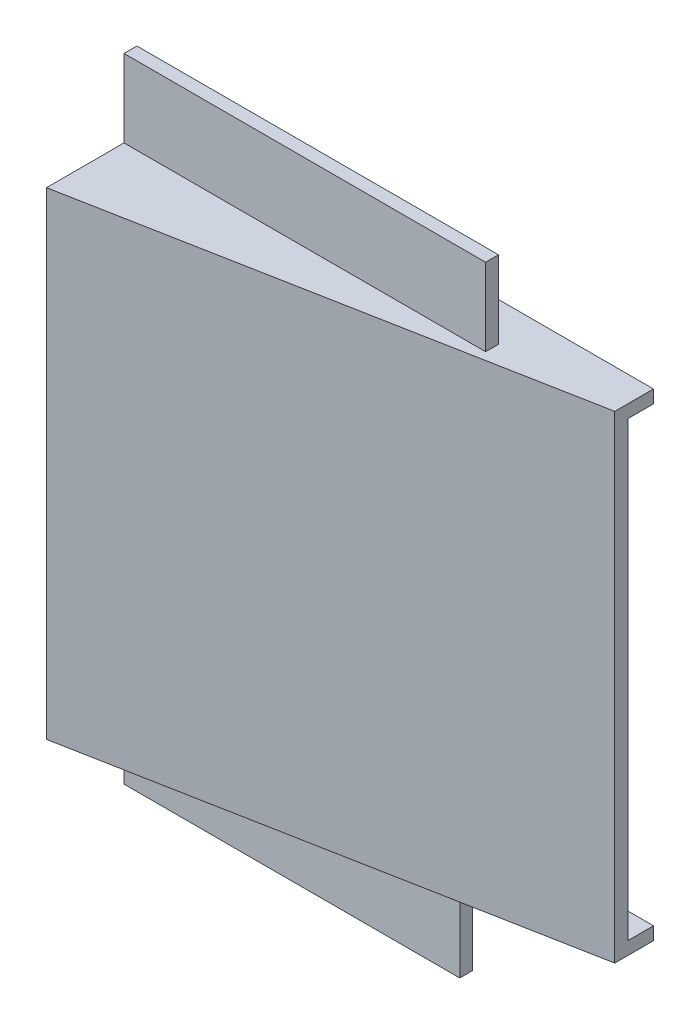
from build123d import *

# Parameters (mm, degrees)
SKETCH1_W           = 185
SKETCH1_H           = 185
BOSS_EXTRUDE1_DEPTH = 50
CUT_EXTRUDE1_DEPTH  = 190
CUT_EXTRUDE3_START  = -5
CUT_EXTRUDE3_DEPTH  = 175
SKETCH10_W          = 130
SKETCH10_H          = 5
BOSS_EXTRUDE2_DEPTH = 30
SKETCH11_W          = 140
SKETCH11_H          = 5
BOSS_EXTRUDE3_DEPTH = 30


with BuildPart() as part:
    # Sketch1 → Boss-Extrude1 (new body)
    with BuildSketch(Plane.XY):
        with Locations((92.5, -92.5)):
            Rectangle(SKETCH1_W, SKETCH1_H)
    extrude(amount=BOSS_EXTRUDE1_DEPTH)

    # Sketch8 → Cut-Extrude1 (cut)
    with BuildSketch(Plane.XZ.offset(185)):
        Polygon((0, 50), (185, 15), (185, 50), align=None)
    extrude(amount=-CUT_EXTRUDE1_DEPTH, mode=Mode.SUBTRACT)

    # Sketch9 → Cut-Extrude3 (cut)
    with BuildSketch(Plane.XZ.offset(185).offset(CUT_EXTRUDE3_START)):
        Polygon((185, 9.911305302), (5, 43.965359356), (5, 0), (185, 0), align=None)
    extrude(amount=-CUT_EXTRUDE3_DEPTH, mode=Mode.SUBTRACT)

    # Sketch10 → Boss-Extrude2 (add)
    with BuildSketch(Plane.XZ.offset(185)):
        with Locations((65, 17.5)):
            Rectangle(SKETCH10_W, SKETCH10_H)
    extrude(amount=BOSS_EXTRUDE2_DEPTH)

    # Sketch11 → Boss-Extrude3 (add)
    with BuildSketch(Plane(origin=(0, 0, 0), x_dir=(1, 0, 0), z_dir=(0, 1, 0))):
        with Locations((70, -17.5)):
            Rectangle(SKETCH11_W, SKETCH11_H)
    extrude(amount=BOSS_EXTRUDE3_DEPTH)


solid = part.part
